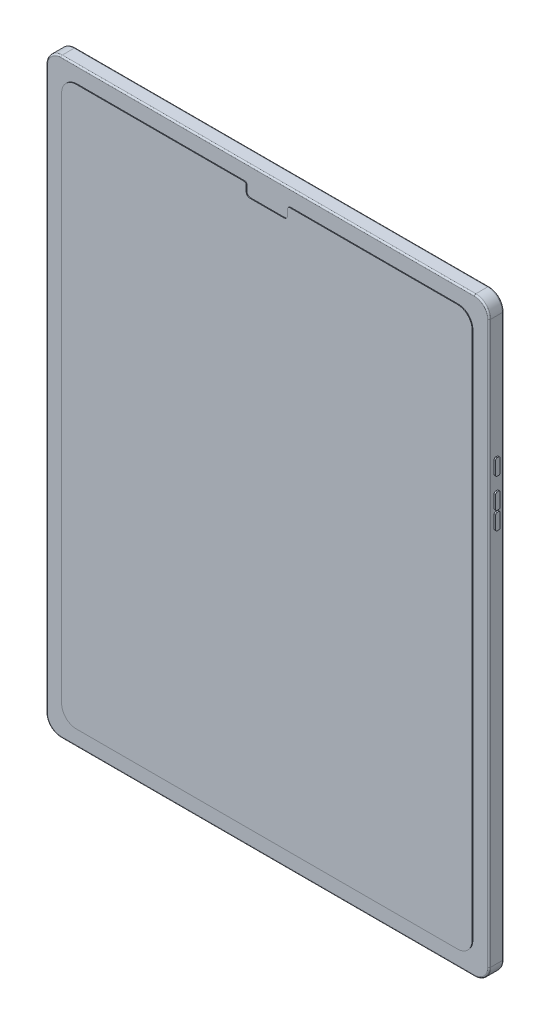
from build123d import *

# Parameters (mm, degrees)
SKETCH1_W           = 30
SKETCH1_H           = 40
BOSS_EXTRUDE1_DEPTH = 1
FILLET1_R           = 1
FILLET2_R           = 0.1
BOSS_EXTRUDE3_DEPTH = 0.05
BOSS_EXTRUDE4_DEPTH = 0.1
SKETCH4_R           = 0.05
CUT_EXTRUDE1_DEPTH  = 0.1
CUT_EXTRUDE2_DEPTH  = 1.5
SKETCH6_R           = 0.125
CUT_EXTRUDE3_DEPTH  = 1
SKETCH7_R           = 0.222610596
SKETCH7_R_2         = 0.109015344
CUT_EXTRUDE4_DEPTH  = 1
SKETCH8_W           = 0.224358974
SKETCH8_H           = 2.5
BOSS_EXTRUDE5_DEPTH = 0.02
SKETCH9_R           = 1.053598775
BOSS_EXTRUDE6_DEPTH = 0.5
FILLET3_R           = 0.25
SKETCH10_R          = 0.195148771
BOSS_EXTRUDE7_DEPTH = 0.1
FILLET4_R           = 0.05


with BuildPart() as part:
    # Sketch1 → Boss-Extrude1 (new body)
    with BuildSketch(Plane.XY):
        Rectangle(SKETCH1_W, SKETCH1_H)
    extrude(amount=BOSS_EXTRUDE1_DEPTH)

    # Fillet1
    fillet1_edges = [part.edges().sort_by_distance(p)[0] for p in [
        (15, -20, 0.5),
        (-15, -20, 0.5),
        (-15, 20, 0.5),
        (15, 20, 0.5),
    ]]
    fillet(fillet1_edges, radius=FILLET1_R)

    # Fillet2
    fillet2_edges = [part.edges().sort_by_distance(p)[0] for p in [
        (15, 0, 0),
        (15, 0, 1),
        (0, -20, 0),
        (-15, 0, 0),
        (0, 20, 0),
        (14.707106781, 19.707106781, 0),
        (-14.707106781, 19.707106781, 0),
        (-14.707106781, -19.707106781, 0),
        (14.707106781, -19.707106781, 0),
        (0, -20, 1),
        (0, 20, 1),
        (-15, 0, 1),
        (14.707106781, 19.707106781, 1),
        (-14.707106781, 19.707106781, 1),
        (-14.707106781, -19.707106781, 1),
        (14.707106781, -19.707106781, 1),
    ]]
    fillet(fillet2_edges, radius=FILLET2_R)

    # Sketch2 → Boss-Extrude3 (add)
    with BuildSketch(Plane.XY.offset(1)):
        with BuildLine():
            Line((-1.55, 18.9), (-12.9, 18.9))
            ThreePointArc((-12.9, 18.9), (-13.607106781, 18.607106781), (-13.9, 17.9))
            Line((-13.9, 17.9), (-13.9, -17.9))
            ThreePointArc((-13.9, -17.9), (-13.607106781, -18.607106781), (-12.9, -18.9))
            Line((-12.9, -18.9), (12.9, -18.9))
            ThreePointArc((12.9, -18.9), (13.607106781, -18.607106781), (13.9, -17.9))
            Line((13.9, -17.9), (13.9, 17.9))
            ThreePointArc((13.9, 17.9), (13.607106781, 18.607106781), (12.9, 18.9))
            Line((12.9, 18.9), (1.55, 18.9))
            ThreePointArc((1.55, 18.9), (1.443933983, 18.856066017), (1.4, 18.75))
            Line((1.4, 18.75), (1.4, 18.35))
            ThreePointArc((1.4, 18.35), (1.326776695, 18.173223305), (1.15, 18.1))
            Line((1.15, 18.1), (-1.15, 18.1))
            ThreePointArc((-1.15, 18.1), (-1.326776695, 18.173223305), (-1.4, 18.35))
            Line((-1.4, 18.35), (-1.4, 18.75))
            ThreePointArc((-1.4, 18.75), (-1.443933983, 18.856066017), (-1.55, 18.9))
        make_face()
    extrude(amount=BOSS_EXTRUDE3_DEPTH)

    # Sketch3 → Boss-Extrude4 (add)
    with BuildSketch(Plane(origin=(15, 0, 0), x_dir=(0, 0, -1), z_dir=(1, 0, 0))):
        with BuildLine():
            Line((-0.657012748, 8.65829626), (-0.657012748, 7.774063936))
            ThreePointArc((-0.657012748, 7.774063936), (-0.627723426, 7.703353258), (-0.557012748, 7.674063936))
            Line((-0.557012748, 7.674063936), (-0.45569959, 7.674063936))
            ThreePointArc((-0.45569959, 7.674063936), (-0.384988911, 7.703353258), (-0.35569959, 7.774063936))
            Line((-0.35569959, 7.774063936), (-0.35569959, 8.65829626))
            ThreePointArc((-0.35569959, 8.65829626), (-0.384988911, 8.729006938), (-0.45569959, 8.75829626))
            Line((-0.45569959, 8.75829626), (-0.557012748, 8.75829626))
            ThreePointArc((-0.557012748, 8.75829626), (-0.627723426, 8.729006938), (-0.657012748, 8.65829626))
        make_face()
        with BuildLine():
            Line((-0.557012748, 10.75829626), (-0.45569959, 10.75829626))
            ThreePointArc((-0.45569959, 10.75829626), (-0.384988911, 10.729006938), (-0.35569959, 10.65829626))
            Line((-0.35569959, 10.65829626), (-0.35569959, 9.774063936))
            ThreePointArc((-0.35569959, 9.774063936), (-0.384988911, 9.703353258), (-0.45569959, 9.674063936))
            Line((-0.45569959, 9.674063936), (-0.557012748, 9.674063936))
            ThreePointArc((-0.557012748, 9.674063936), (-0.627723426, 9.703353258), (-0.657012748, 9.774063936))
            Line((-0.657012748, 9.774063936), (-0.657012748, 10.65829626))
            ThreePointArc((-0.657012748, 10.65829626), (-0.627723426, 10.729006938), (-0.557012748, 10.75829626))
        make_face()
        with BuildLine():
            Line((-0.657012748, 7.45829626), (-0.657012748, 6.574063936))
            ThreePointArc((-0.657012748, 6.574063936), (-0.627723426, 6.503353258), (-0.557012748, 6.474063936))
            Line((-0.557012748, 6.474063936), (-0.45569959, 6.474063936))
            ThreePointArc((-0.45569959, 6.474063936), (-0.384988911, 6.503353258), (-0.35569959, 6.574063936))
            Line((-0.35569959, 6.574063936), (-0.35569959, 7.45829626))
            ThreePointArc((-0.35569959, 7.45829626), (-0.384988911, 7.529006938), (-0.45569959, 7.55829626))
            Line((-0.45569959, 7.55829626), (-0.557012748, 7.55829626))
            ThreePointArc((-0.557012748, 7.55829626), (-0.627723426, 7.529006938), (-0.657012748, 7.45829626))
        make_face()
    extrude(amount=BOSS_EXTRUDE4_DEPTH)

    # Sketch4 → Cut-Extrude1 (cut)
    with BuildSketch(Plane.ZY.offset(15)):
        with Locations(Location((0.5, -17.610032168, 0), (0, 0, 270))):
            Circle(SKETCH4_R)
        with Locations(Location((0.5, -17.453725708, 0), (0, 0, 270))):
            Circle(SKETCH4_R)
    extrude(amount=-CUT_EXTRUDE1_DEPTH, mode=Mode.SUBTRACT)

    # Sketch5 → Cut-Extrude2 (cut)
    with BuildSketch(Plane.XZ.offset(20)):
        with BuildLine():
            Line((-0.5, 0.697077304), (0.5, 0.697077304))
            ThreePointArc((0.5, 0.697077304), (0.718361071, 0.478716233), (0.5, 0.260355162))
            Line((0.5, 0.260355162), (-0.5, 0.260355162))
            ThreePointArc((-0.5, 0.260355162), (-0.718361071, 0.478716233), (-0.5, 0.697077304))
        make_face()
    extrude(amount=-CUT_EXTRUDE2_DEPTH, mode=Mode.SUBTRACT)

    # Sketch6 → Cut-Extrude3 (cut)
    with BuildSketch(Plane.XZ.offset(20)):
        with Locations(Location((-12, 0.476965853, 0), (0, 0, 270))):
            Circle(SKETCH6_R)
        with Locations(Location((-11.5, 0.476965853, 0), (0, 0, 270))):
            Circle(SKETCH6_R)
        with Locations(Location((-11, 0.476965853, 0), (0, 0, 270))):
            Circle(SKETCH6_R)
        with Locations(Location((-10.5, 0.476965853, 0), (0, 0, 270))):
            Circle(SKETCH6_R)
        with Locations(Location((-10, 0.476965853, 0), (0, 0, 270))):
            Circle(SKETCH6_R)
        with Locations(Location((12, 0.5, 0), (0, 0, 270))):
            Circle(SKETCH6_R)
        with Locations(Location((11.5, 0.5, 0), (0, 0, 270))):
            Circle(SKETCH6_R)
        with Locations(Location((11, 0.5, 0), (0, 0, 270))):
            Circle(SKETCH6_R)
        with Locations(Location((10.5, 0.5, 0), (0, 0, 270))):
            Circle(SKETCH6_R)
        with Locations(Location((10, 0.5, 0), (0, 0, 270))):
            Circle(SKETCH6_R)
    extrude(amount=-CUT_EXTRUDE3_DEPTH, mode=Mode.SUBTRACT)

    # Sketch7 → Cut-Extrude4 (cut)
    with BuildSketch(Plane.XZ.offset(20)):
        with Locations(Location((-3.207652456, 0.536786197, 0), (0, 0, 270))):
            Circle(SKETCH7_R)
        with Locations(Location((-2.279239087, 0.536786197, 0), (0, 0, 270))):
            Circle(SKETCH7_R_2)
    extrude(amount=-CUT_EXTRUDE4_DEPTH, mode=Mode.SUBTRACT)

    # Sketch8 → Boss-Extrude5 (add)
    # profile 1 of 7: a face of its own
    with BuildSketch(Plane(origin=(0, 0, 0), x_dir=(-1, 0, 0), z_dir=(0, 0, -1))):
        with Locations((-7.255352287, 1.25)):
            Rectangle(SKETCH8_W, SKETCH8_H)
    # profile 2 of 7: a face of its own
    with BuildSketch(Plane(origin=(0, 0, 0), x_dir=(-1, 0, 0), z_dir=(0, 0, -1))):
        with BuildLine():
            Line((-6.566249723, 1.826923077), (-6.341890749, 1.826923077))
            Line((-6.341890749, 1.826923077), (-6.341890749, 1.497395833))
            add(Edge.make_bspline(
                [(-6.341890749, 1.497395833), (-6.317935295, 1.527283493), (-6.271448901, 1.585281538), (-6.19403152, 1.66151052), (-6.112214449, 1.724328538), (-6.026498732, 1.774402676), (-5.93676801, 1.812150266), (-5.843569246, 1.839411646), (-5.746344456, 1.855757952), (-5.680227001, 1.85789383), (-5.646778569, 1.858974359)],
                knots=[0, 0, 0, 0, 1.12780773, 2.188550248, 3.19190651, 4.159438251, 5.104880172, 6.052711206, 7.014878035, 8, 8, 8, 8], degree=3))
            add(Edge.make_bspline(
                [(-5.646778569, 1.858974359), (-5.612970973, 1.857727791), (-5.546801353, 1.855287956), (-5.450459881, 1.83599032), (-5.360478886, 1.803029423), (-5.277179203, 1.757877944), (-5.202088336, 1.701730463), (-5.136142014, 1.636317762), (-5.081596837, 1.561077703), (-5.045027292, 1.491275448), (-5.020937544, 1.429354881), (-5.005771588, 1.376321488), (-4.992892316, 1.317237094), (-4.981726781, 1.252280245), (-4.974171702, 1.180995823), (-4.968212922, 1.103676043), (-4.963942426, 1.02034595), (-4.963772992, 0.962712645), (-4.96368562, 0.932992788)],
                knots=[0, 0, 0, 0, 1.235846778, 2.418850247, 3.575807741, 4.728682307, 5.871620074, 6.994088408, 8.11269785, 9.256955736, 9.865816715, 10.540099792, 11.271859618, 12.076849838, 12.949306005, 13.892391288, 14.913166135, 16, 16, 16, 16], degree=3))
            Line((-4.96368562, 0.932992788), (-4.96368562, 0))
            Line((-4.96368562, 0), (-5.188044595, 0))
            Line((-5.188044595, 0), (-5.188044595, 0.859375))
            add(Edge.make_bspline(
                [(-5.188044595, 0.859375), (-5.1881826, 0.884248175), (-5.188446582, 0.931826326), (-5.189279187, 0.999947056), (-5.191286191, 1.061723184), (-5.194106415, 1.117007018), (-5.198234294, 1.165745472), (-5.202536173, 1.208037813), (-5.207796871, 1.243830343), (-5.212484666, 1.265376831), (-5.214587063, 1.275040064)],
                knots=[0, 0, 0, 0, 1.430800155, 2.736877192, 3.918605307, 4.986035426, 5.920637409, 6.731861385, 7.431261377, 8, 8, 8, 8], degree=3))
            add(Edge.make_bspline(
                [(-5.214587063, 1.275040064), (-5.222176728, 1.303405196), (-5.236784486, 1.3579993), (-5.272880188, 1.432052409), (-5.318461746, 1.495051114), (-5.374103067, 1.546605915), (-5.439266692, 1.586727941), (-5.513771794, 1.614566481), (-5.596899394, 1.631978101), (-5.655366811, 1.633711767), (-5.685841069, 1.634615385)],
                knots=[0, 0, 0, 0, 1.084156227, 2.086665306, 3.027808233, 3.945421172, 4.874247719, 5.839848303, 6.874090471, 8, 8, 8, 8], degree=3))
            add(Edge.make_bspline(
                [(-5.685841069, 1.634615385), (-5.703889415, 1.634275381), (-5.739606624, 1.633602523), (-5.792570889, 1.626851596), (-5.843945299, 1.615809842), (-5.894245448, 1.600903673), (-5.942465301, 1.580430623), (-5.99015408, 1.557195359), (-6.035516055, 1.52823235), (-6.079518481, 1.495953335), (-6.120456201, 1.460182473), (-6.158547871, 1.422436394), (-6.1925036, 1.382239534), (-6.223266939, 1.340239572), (-6.249822842, 1.295859687), (-6.273003619, 1.24952804), (-6.292671972, 1.201183648), (-6.302445324, 1.167630033), (-6.30733546, 1.150841346)],
                knots=[0, 0, 0, 0, 1.023777757, 2.026029729, 3.023749952, 4.003683103, 4.997618607, 5.993177895, 7.010360494, 8.046726602, 9.087585522, 10.09234134, 11.086953743, 12.070360549, 13.043493632, 14.017870808, 15.008233677, 16, 16, 16, 16], degree=3))
            add(Edge.make_bspline(
                [(-6.30733546, 1.150841346), (-6.310149495, 1.138516201), (-6.316275501, 1.111685005), (-6.322892058, 1.067653277), (-6.328897469, 1.016717581), (-6.333923868, 0.958937354), (-6.336999166, 0.8941103), (-6.340352306, 0.822513273), (-6.341573064, 0.743860782), (-6.341781888, 0.68910243), (-6.341890749, 0.660556891)],
                knots=[0, 0, 0, 0, 0.615963638, 1.340920617, 2.168419149, 3.115676021, 4.16674242, 5.331190069, 6.6087489, 8, 8, 8, 8], degree=3))
            Line((-6.341890749, 0.660556891), (-6.341890749, 0))
            Line((-6.341890749, 0), (-6.566249723, 0))
            Line((-6.566249723, 0), (-6.566249723, 1.826923077))
        make_face()
    # profile 3 of 7: a face of its own
    with BuildSketch(Plane(origin=(0, 0, 0), x_dir=(-1, 0, 0), z_dir=(0, 0, -1))):
        with BuildLine():
            Line((-4.450865108, 1.826923077), (-4.226506133, 1.826923077))
            Line((-4.226506133, 1.826923077), (-4.226506133, 1.497395833))
            add(Edge.make_bspline(
                [(-4.226506133, 1.497395833), (-4.20255068, 1.527283493), (-4.156064286, 1.585281538), (-4.078646905, 1.66151052), (-3.996829833, 1.724328538), (-3.911114117, 1.774402676), (-3.821383395, 1.812150266), (-3.728184631, 1.839411646), (-3.630959841, 1.855757952), (-3.564842386, 1.85789383), (-3.531393954, 1.858974359)],
                knots=[0, 0, 0, 0, 1.12780773, 2.188550248, 3.19190651, 4.159438251, 5.104880172, 6.052711206, 7.014878035, 8, 8, 8, 8], degree=3))
            add(Edge.make_bspline(
                [(-3.531393954, 1.858974359), (-3.497586358, 1.857727791), (-3.431416738, 1.855287956), (-3.335075266, 1.83599032), (-3.24509427, 1.803029423), (-3.161794587, 1.757877944), (-3.086703721, 1.701730463), (-3.020757398, 1.636317762), (-2.966212222, 1.561077703), (-2.929642677, 1.491275448), (-2.905552928, 1.429354881), (-2.890386973, 1.376321488), (-2.8775077, 1.317237094), (-2.866342166, 1.252280245), (-2.858787086, 1.180995823), (-2.852828307, 1.103676043), (-2.848557811, 1.02034595), (-2.848388377, 0.962712645), (-2.848301005, 0.932992788)],
                knots=[0, 0, 0, 0, 1.235846778, 2.418850247, 3.575807741, 4.728682307, 5.871620074, 6.994088408, 8.11269785, 9.256955736, 9.865816715, 10.540099792, 11.271859618, 12.076849838, 12.949306005, 13.892391288, 14.913166135, 16, 16, 16, 16], degree=3))
            Line((-2.848301005, 0.932992788), (-2.848301005, 0))
            Line((-2.848301005, 0), (-3.072659979, 0))
            Line((-3.072659979, 0), (-3.072659979, 0.859375))
            add(Edge.make_bspline(
                [(-3.072659979, 0.859375), (-3.072797985, 0.884248175), (-3.073061967, 0.931826326), (-3.073894571, 0.999947056), (-3.075901576, 1.061723184), (-3.0787218, 1.117007018), (-3.082849678, 1.165745472), (-3.087151558, 1.208037813), (-3.092412256, 1.243830343), (-3.097100051, 1.265376831), (-3.099202447, 1.275040064)],
                knots=[0, 0, 0, 0, 1.430800155, 2.736877192, 3.918605307, 4.986035426, 5.920637409, 6.731861385, 7.431261377, 8, 8, 8, 8], degree=3))
            add(Edge.make_bspline(
                [(-3.099202447, 1.275040064), (-3.106792113, 1.303405196), (-3.12139987, 1.3579993), (-3.157495572, 1.432052409), (-3.20307713, 1.495051114), (-3.258718451, 1.546605915), (-3.323882077, 1.586727941), (-3.398387179, 1.614566481), (-3.481514779, 1.631978101), (-3.539982195, 1.633711767), (-3.570456454, 1.634615385)],
                knots=[0, 0, 0, 0, 1.084156227, 2.086665306, 3.027808233, 3.945421172, 4.874247719, 5.839848303, 6.874090471, 8, 8, 8, 8], degree=3))
            add(Edge.make_bspline(
                [(-3.570456454, 1.634615385), (-3.588504799, 1.634275381), (-3.624222008, 1.633602523), (-3.677186274, 1.626851596), (-3.728560683, 1.615809842), (-3.778860833, 1.600903673), (-3.827080685, 1.580430623), (-3.874769465, 1.557195359), (-3.920131439, 1.52823235), (-3.964133866, 1.495953335), (-4.005071585, 1.460182473), (-4.043163256, 1.422436394), (-4.077118985, 1.382239534), (-4.107882324, 1.340239572), (-4.134438226, 1.295859687), (-4.157619004, 1.24952804), (-4.177287357, 1.201183648), (-4.187060709, 1.167630033), (-4.191950845, 1.150841346)],
                knots=[0, 0, 0, 0, 1.023777757, 2.026029729, 3.023749952, 4.003683103, 4.997618607, 5.993177895, 7.010360494, 8.046726602, 9.087585522, 10.09234134, 11.086953743, 12.070360549, 13.043493632, 14.017870808, 15.008233677, 16, 16, 16, 16], degree=3))
            add(Edge.make_bspline(
                [(-4.191950845, 1.150841346), (-4.194764879, 1.138516201), (-4.200890886, 1.111685005), (-4.207507443, 1.067653277), (-4.213512854, 1.016717581), (-4.218539253, 0.958937354), (-4.22161455, 0.8941103), (-4.224967691, 0.822513273), (-4.226188449, 0.743860782), (-4.226397273, 0.68910243), (-4.226506133, 0.660556891)],
                knots=[0, 0, 0, 0, 0.615963638, 1.340920617, 2.168419149, 3.115676021, 4.16674242, 5.331190069, 6.6087489, 8, 8, 8, 8], degree=3))
            Line((-4.226506133, 0.660556891), (-4.226506133, 0))
            Line((-4.226506133, 0), (-4.450865108, 0))
            Line((-4.450865108, 0), (-4.450865108, 1.826923077))
        make_face()
    # profile 4 of 7: a face of its own
    with BuildSketch(Plane(origin=(0, 0, 0), x_dir=(-1, 0, 0), z_dir=(0, 0, -1))):
        with BuildLine():
            add(Edge.make_bspline(
                [(-1.453068633, 1.858974359), (-1.418789153, 1.858244437), (-1.351575469, 1.856813238), (-1.253141264, 1.841516834), (-1.159180453, 1.818125859), (-1.069333173, 1.785789029), (-0.984750105, 1.742444779), (-0.904199216, 1.690723856), (-0.827901353, 1.629450575), (-0.782170617, 1.582051955), (-0.758958056, 1.557992788)],
                knots=[0, 0, 0, 0, 1.054011418, 2.066658804, 3.057071809, 4.030435133, 4.997543892, 5.974964718, 6.972108034, 8, 8, 8, 8], degree=3))
            add(Edge.make_bspline(
                [(-0.758958056, 1.557992788), (-0.738970946, 1.534982799), (-0.699383532, 1.489408126), (-0.648622304, 1.415511259), (-0.604892618, 1.338982616), (-0.569847646, 1.258805954), (-0.542215486, 1.175681189), (-0.522597132, 1.08932261), (-0.510927893, 0.999920933), (-0.509354345, 0.939203906), (-0.508557415, 0.908453526)],
                knots=[0, 0, 0, 0, 1.025258237, 2.030674902, 3.01204498, 3.988269485, 4.97094183, 5.956517959, 6.965070386, 8, 8, 8, 8], degree=3))
            add(Edge.make_bspline(
                [(-0.508557415, 0.908453526), (-0.50925837, 0.877524913), (-0.510643491, 0.816408532), (-0.523746074, 0.726394699), (-0.544125421, 0.639112683), (-0.57329102, 0.554927902), (-0.610689669, 0.473583025), (-0.656325874, 0.395433347), (-0.710519887, 0.32032468), (-0.771951313, 0.248894796), (-0.83984551, 0.183061785), (-0.913499902, 0.12568445), (-0.991467069, 0.076526218), (-1.07478375, 0.036928779), (-1.162689097, 0.005707564), (-1.255372718, -0.016221019), (-1.352690625, -0.029479365), (-1.41913864, -0.031181917), (-1.453068633, -0.032051282)],
                knots=[0, 0, 0, 0, 0.998656419, 1.973391657, 2.932242238, 3.890759089, 4.846373663, 5.82037756, 6.809684879, 7.83454468, 8.860553229, 9.859544525, 10.845671541, 11.83227036, 12.833544569, 13.85385346, 14.904124723, 16, 16, 16, 16], degree=3))
            add(Edge.make_bspline(
                [(-1.453068633, -0.032051282), (-1.487164861, -0.031178999), (-1.553944047, -0.029470589), (-1.651605463, -0.01627253), (-1.74445519, 0.005697458), (-1.832475618, 0.037031381), (-1.916150509, 0.076527484), (-1.994569435, 0.125535834), (-2.06828366, 0.183078802), (-2.136192221, 0.248890185), (-2.197619796, 0.320325868), (-2.251814802, 0.395433039), (-2.297450749, 0.473583106), (-2.334849466, 0.55492788), (-2.364015047, 0.639112689), (-2.384394399, 0.726394698), (-2.397496981, 0.816408532), (-2.398882101, 0.877524913), (-2.399583056, 0.908453526)],
                knots=[0, 0, 0, 0, 1.099876186, 2.154163076, 3.173186993, 4.173200201, 5.163417411, 6.152872554, 7.150605724, 8.17532212, 9.198891216, 10.186952605, 11.159729845, 12.11414092, 13.071450619, 14.029093627, 15.002601286, 16, 16, 16, 16], degree=3))
            add(Edge.make_bspline(
                [(-2.399583056, 0.908453526), (-2.398780692, 0.939036773), (-2.397192148, 0.999586346), (-2.385534641, 1.088819961), (-2.365992815, 1.175032381), (-2.338327532, 1.257836293), (-2.302959539, 1.337661604), (-2.259844333, 1.414379341), (-2.20856531, 1.487942055), (-2.169135344, 1.533457827), (-2.149182415, 1.556490385)],
                knots=[0, 0, 0, 0, 1.031353054, 2.041901799, 3.029428768, 4.008703097, 4.981709435, 5.96992636, 6.972712378, 8, 8, 8, 8], degree=3))
            add(Edge.make_bspline(
                [(-2.149182415, 1.556490385), (-2.12600485, 1.580758198), (-2.08042209, 1.628485124), (-2.003744428, 1.689579784), (-1.923391698, 1.74237698), (-1.837873894, 1.784859991), (-1.748100424, 1.818316075), (-1.653658108, 1.841577157), (-1.554889883, 1.856758125), (-1.487347296, 1.858228252), (-1.453068633, 1.858974359)],
                knots=[0, 0, 0, 0, 1.027980169, 2.021703884, 2.998553061, 3.971491411, 4.943284454, 5.930300938, 6.949603206, 8, 8, 8, 8], degree=3))
        make_face()
        with BuildLine():
            add(Edge.make_bspline(
                [(-1.454070236, 1.634615385), (-1.478311387, 1.633926391), (-1.526167907, 1.632566189), (-1.596610468, 1.622220543), (-1.664424863, 1.605829468), (-1.729739752, 1.582540857), (-1.792334875, 1.552470214), (-1.852270163, 1.515535671), (-1.909721905, 1.472226417), (-1.963566236, 1.422610223), (-2.012982174, 1.368410941), (-2.056180728, 1.310662113), (-2.092912947, 1.250300437), (-2.123513061, 1.187263144), (-2.146303909, 1.120911419), (-2.162856068, 1.051996683), (-2.173191954, 0.980378528), (-2.174539368, 0.931692087), (-2.175224082, 0.906951122)],
                knots=[0, 0, 0, 0, 1.021534396, 2.016698045, 2.994645724, 3.958388632, 4.93408049, 5.916473867, 6.921342795, 7.962252576, 8.998418191, 10.008913653, 10.997312074, 11.973003931, 12.956656626, 13.948281152, 14.957379055, 16, 16, 16, 16], degree=3))
            add(Edge.make_bspline(
                [(-2.175224082, 0.906951122), (-2.174076351, 0.874985388), (-2.171798319, 0.811539384), (-2.15327315, 0.718102868), (-2.12228295, 0.628401545), (-2.080434893, 0.542961269), (-2.02800188, 0.463909642), (-1.966225404, 0.39343001), (-1.895768475, 0.332583002), (-1.817470975, 0.282096684), (-1.732932176, 0.241982573), (-1.643463375, 0.213554733), (-1.550148594, 0.195074953), (-1.486376643, 0.193238185), (-1.454070236, 0.192307692)],
                knots=[0, 0, 0, 0, 1.016792936, 2.018143844, 3.017858371, 4.030088057, 5.03801393, 6.028138512, 7.003788237, 7.991172063, 8.984598303, 9.972568034, 10.972917682, 12, 12, 12, 12], degree=3))
            add(Edge.make_bspline(
                [(-1.454070236, 0.192307692), (-1.421765686, 0.193243607), (-1.357997404, 0.195091076), (-1.264812277, 0.213461661), (-1.175588012, 0.242107133), (-1.091137021, 0.282051569), (-1.012875161, 0.332774722), (-0.941911503, 0.39308642), (-0.880662495, 0.464096314), (-0.828281349, 0.543065978), (-0.785747961, 0.628269086), (-0.754902817, 0.718119424), (-0.736333113, 0.811535168), (-0.734061092, 0.874983976), (-0.73291639, 0.906951122)],
                knots=[0, 0, 0, 0, 1.02726834, 2.027799167, 3.010890988, 4.004497153, 4.992059811, 5.971914811, 6.958719428, 7.966827853, 8.981595046, 9.981490638, 10.983022906, 12, 12, 12, 12], degree=3))
            add(Edge.make_bspline(
                [(-0.73291639, 0.906951122), (-0.733600868, 0.931692234), (-0.734947818, 0.980378967), (-0.745287078, 1.051995005), (-0.761826749, 1.120917574), (-0.784663618, 1.187240434), (-0.815130771, 1.250463651), (-0.852571338, 1.310484885), (-0.895593499, 1.368610989), (-0.945605728, 1.422435018), (-0.999393855, 1.472245759), (-1.056868882, 1.515552465), (-1.116715296, 1.552307891), (-1.179128569, 1.582798063), (-1.244451831, 1.605617591), (-1.312171209, 1.622315185), (-1.382313217, 1.632522469), (-1.429998247, 1.633913284), (-1.454070236, 1.634615385)],
                knots=[0, 0, 0, 0, 1.042956736, 2.052379634, 3.044323526, 4.02829302, 5.004299113, 5.996692471, 7.007513377, 8.048758398, 9.090003419, 10.095195979, 11.07790575, 12.047570684, 13.018257071, 13.989683339, 14.985167495, 16, 16, 16, 16], degree=3))
        make_face(mode=Mode.SUBTRACT)
    # profile 5 of 7: a face of its own
    with BuildSketch(Plane(origin=(0, 0, 0), x_dir=(-1, 0, 0), z_dir=(0, 0, -1))):
        with BuildLine():
            Line((2.311955405, 2.041266026), (2.115641303, 1.891025641))
            add(Edge.make_bspline(
                [(2.115641303, 1.891025641), (2.101637097, 1.907715619), (2.073817492, 1.940870559), (2.029060919, 1.987427377), (1.982416888, 2.031045421), (1.93390323, 2.071932478), (1.882646716, 2.108658739), (1.829889003, 2.143138098), (1.774747542, 2.174043625), (1.698496303, 2.211517187), (1.59874784, 2.250621583), (1.473180098, 2.283409605), (1.342100742, 2.304281874), (1.252673885, 2.306542475), (1.207187777, 2.307692308)],
                knots=[0, 0, 0, 0, 0.757959112, 1.505699292, 2.245454638, 2.979532153, 3.711538275, 4.438200793, 5.171680507, 5.909471876, 7.393775596, 8.890124382, 10.418191784, 12, 12, 12, 12], degree=3))
            add(Edge.make_bspline(
                [(1.207187777, 2.307692308), (1.182128278, 2.307403763), (1.132241854, 2.306829352), (1.05820723, 2.299251405), (0.985555051, 2.288600541), (0.914332575, 2.272796739), (0.844630462, 2.252816296), (0.775993032, 2.228941001), (0.709414032, 2.199401829), (0.643972433, 2.166753072), (0.581272997, 2.129876326), (0.521947963, 2.089652503), (0.4662137, 2.04653172), (0.41402612, 2.000352358), (0.365331871, 1.951322387), (0.320483792, 1.898919285), (0.27963707, 1.84331059), (0.241982052, 1.785229585), (0.208258671, 1.724845448), (0.180023043, 1.661934683), (0.155019384, 1.59757461), (0.135234211, 1.531038066), (0.119573842, 1.462793233), (0.108768368, 1.392656956), (0.101276603, 1.320775757), (0.100705048, 1.272054819), (0.100416944, 1.247495994)],
                knots=[0, 0, 0, 0, 1.054917814, 2.100044995, 3.131103042, 4.146048494, 5.169673617, 6.183595914, 7.203665975, 8.234915748, 9.262203917, 10.264457458, 11.251630812, 12.227803204, 13.197192746, 14.159520551, 15.12972552, 16.100847026, 17.073214652, 18.039054194, 19.002613845, 19.979014051, 20.95965708, 21.949030935, 22.966165397, 24, 24, 24, 24], degree=3))
            add(Edge.make_bspline(
                [(0.100416944, 1.247495994), (0.101318243, 1.210545051), (0.103087825, 1.137996776), (0.118836635, 1.031732054), (0.142768843, 0.929931573), (0.178637112, 0.833231685), (0.222865005, 0.740440001), (0.278751156, 0.653126534), (0.343477254, 0.569971845), (0.417958983, 0.492941168), (0.499677423, 0.422574222), (0.587354502, 0.360609521), (0.680771851, 0.308956033), (0.778898015, 0.265973214), (0.882488097, 0.232932695), (0.991355813, 0.209672606), (1.105264381, 0.19449962), (1.183099666, 0.193046986), (1.222712617, 0.192307692)],
                knots=[0, 0, 0, 0, 1.029171465, 2.020641659, 2.987623507, 3.938342917, 4.889210282, 5.84687017, 6.821220943, 7.821438502, 8.827599549, 9.822697543, 10.807740252, 11.797342354, 12.80366471, 13.83203677, 14.896651826, 16, 16, 16, 16], degree=3))
            add(Edge.make_bspline(
                [(1.222712617, 0.192307692), (1.266357395, 0.193513964), (1.352260758, 0.195888194), (1.47823792, 0.216001943), (1.598834895, 0.248614742), (1.714058171, 0.294256115), (1.823582919, 0.353588463), (1.927580533, 0.425515519), (2.026138798, 0.510721471), (2.085403999, 0.575780848), (2.115641303, 0.608974359)],
                knots=[0, 0, 0, 0, 1.028121516, 2.023589091, 2.998037872, 3.967518031, 4.937445131, 5.927275754, 6.942489185, 8, 8, 8, 8], degree=3))
            Line((2.115641303, 0.608974359), (2.311955405, 0.460236378))
            add(Edge.make_bspline(
                [(2.311955405, 0.460236378), (2.296156755, 0.43985177), (2.26463513, 0.399180194), (2.213593689, 0.341843258), (2.159824191, 0.287911804), (2.102927256, 0.237820646), (2.043557404, 0.190567457), (1.98064861, 0.14749472), (1.915027872, 0.108001231), (1.84691753, 0.071839142), (1.77638995, 0.039755394), (1.703529639, 0.012288417), (1.628650657, -0.011372218), (1.551749579, -0.030837887), (1.472666896, -0.046031518), (1.391687986, -0.056188429), (1.308638075, -0.063146939), (1.252608488, -0.063781165), (1.224215021, -0.064102564)],
                knots=[0, 0, 0, 0, 0.986787822, 1.968848986, 2.935600012, 3.899624008, 4.868462664, 5.837806735, 6.815139263, 7.798259679, 8.787526145, 9.778297419, 10.776456485, 11.791383307, 12.812564526, 13.85620153, 14.913611965, 16, 16, 16, 16], degree=3))
            add(Edge.make_bspline(
                [(1.224215021, -0.064102564), (1.197326687, -0.063915427), (1.144158337, -0.063545385), (1.065659229, -0.05755098), (0.9892381, -0.049372596), (0.915113367, -0.037058217), (0.842880527, -0.022526546), (0.773194396, -0.003047077), (0.705369245, 0.018773757), (0.639677574, 0.044420176), (0.576063502, 0.073360306), (0.514732208, 0.106068562), (0.4557119, 0.142269894), (0.398422313, 0.18116633), (0.343709753, 0.22400726), (0.291100092, 0.270197714), (0.240298324, 0.319582007), (0.208867834, 0.355192616), (0.193065181, 0.373096955)],
                knots=[0, 0, 0, 0, 1.114604814, 2.203992996, 3.262667896, 4.300477797, 5.318619304, 6.316056647, 7.298880507, 8.271930387, 9.238335007, 10.195173496, 11.151986948, 12.108099108, 13.064862484, 14.031167946, 15.010108607, 16, 16, 16, 16], degree=3))
            add(Edge.make_bspline(
                [(0.193065181, 0.373096955), (0.167754007, 0.404197804), (0.117437238, 0.466024026), (0.05306175, 0.566228298), (-0.002043647, 0.670848448), (-0.046597876, 0.780434111), (-0.0814284, 0.894739388), (-0.105557825, 1.013821898), (-0.121237542, 1.137570428), (-0.123030606, 1.221739563), (-0.123942031, 1.264523237)],
                knots=[0, 0, 0, 0, 0.994628077, 1.977248131, 2.950237994, 3.925870899, 4.908910175, 5.911660606, 6.938484602, 8, 8, 8, 8], degree=3))
            add(Edge.make_bspline(
                [(-0.123942031, 1.264523237), (-0.122831178, 1.309491418), (-0.120645645, 1.397963507), (-0.10207722, 1.527802045), (-0.072206651, 1.652195902), (-0.029780302, 1.770912862), (0.024009235, 1.884577348), (0.090456816, 1.992321066), (0.168790489, 2.094833065), (0.258395894, 2.190557888), (0.356658277, 2.278085997), (0.461886001, 2.355090428), (0.573873106, 2.419174368), (0.691385857, 2.472743056), (0.815304201, 2.513917672), (0.945363751, 2.542741377), (1.081320118, 2.560682174), (1.174078994, 2.56295018), (1.221210213, 2.564102564)],
                knots=[0, 0, 0, 0, 1.032925535, 2.032216505, 3.007276963, 3.968222605, 4.92396291, 5.891752235, 6.871517503, 7.883894988, 8.900124299, 9.891468569, 10.874487609, 11.85992873, 12.854644235, 13.869047385, 14.917252991, 16, 16, 16, 16], degree=3))
            add(Edge.make_bspline(
                [(1.221210213, 2.564102564), (1.249934836, 2.56375818), (1.306792334, 2.563076505), (1.390901371, 2.556429261), (1.472788748, 2.545348114), (1.552510878, 2.530265207), (1.630455604, 2.511545691), (1.706027204, 2.487159764), (1.779669123, 2.459276527), (1.850916915, 2.427163337), (1.919428736, 2.391115665), (1.98518325, 2.351533077), (2.047658149, 2.308464644), (2.107293041, 2.262276662), (2.163090334, 2.211991977), (2.216634247, 2.158993694), (2.266106446, 2.101755248), (2.296644442, 2.061466009), (2.311955405, 2.041266026)],
                knots=[0, 0, 0, 0, 1.096760587, 2.17092713, 3.219439832, 4.250915756, 5.268269357, 6.278326846, 7.281116186, 8.274029601, 9.260640565, 10.235837813, 11.203064059, 12.156899882, 13.114053108, 14.069676657, 15.032185724, 16, 16, 16, 16], degree=3))
        make_face()
    # profile 6 of 7: a face of its own
    with BuildSketch(Plane(origin=(0, 0, 0), x_dir=(-1, 0, 0), z_dir=(0, 0, -1))):
        Polygon((3.850416944, 2.5), (5.004263098, 0), (4.760372873, 0), (4.390781527, 0.801282051), (3.257468226, 0.801282051), (2.877860854, 0), (2.632468226, 0), (3.818365662, 2.5), align=None)
        Polygon((3.831887296, 2.012219551), (3.379663739, 1.057692308), (4.272592425, 1.057692308), align=None, mode=Mode.SUBTRACT)
    # profile 7 of 7: a face of its own
    with BuildSketch(Plane(origin=(0, 0, 0), x_dir=(-1, 0, 0), z_dir=(0, 0, -1))):
        with BuildLine():
            Line((5.452981046, 0), (5.452981046, 2.5))
            Line((5.452981046, 2.5), (5.957788739, 2.5))
            add(Edge.make_bspline(
                [(5.957788739, 2.5), (6.001695159, 2.499683879), (6.086522134, 2.499073134), (6.209102454, 2.495200711), (6.322519427, 2.488350379), (6.42640004, 2.478372146), (6.521029478, 2.466119979), (6.606142769, 2.450762547), (6.682180014, 2.43262814), (6.7289439, 2.417167104), (6.751057969, 2.409855769)],
                knots=[0, 0, 0, 0, 1.314313732, 2.53924729, 3.670748893, 4.714932338, 5.66265055, 6.526160246, 7.303039223, 8, 8, 8, 8], degree=3))
            add(Edge.make_bspline(
                [(6.751057969, 2.409855769), (6.779982783, 2.398833837), (6.837176492, 2.377039912), (6.918610151, 2.335928268), (6.995271124, 2.289347482), (7.067570514, 2.237236151), (7.133856818, 2.178118759), (7.196719602, 2.114506555), (7.253587261, 2.044086312), (7.305664616, 1.968318464), (7.352618658, 1.888095569), (7.393432342, 1.803570492), (7.427328052, 1.715172486), (7.455466071, 1.62314738), (7.477642112, 1.527292825), (7.492772063, 1.427497206), (7.502751342, 1.324154928), (7.503754236, 1.254030311), (7.504263098, 1.218449519)],
                knots=[0, 0, 0, 0, 0.984719456, 1.947108742, 2.898477687, 3.838006223, 4.779231079, 5.722358779, 6.681677486, 7.655904652, 8.64651281, 9.637519902, 10.640069247, 11.656948941, 12.698408672, 13.768548281, 14.867775369, 16, 16, 16, 16], degree=3))
            add(Edge.make_bspline(
                [(7.504263098, 1.218449519), (7.503813835, 1.187548635), (7.502928516, 1.126655214), (7.494979005, 1.036911717), (7.483424491, 0.949830595), (7.465535778, 0.865826523), (7.443819697, 0.78416351), (7.41598816, 0.705711907), (7.384105663, 0.629752044), (7.346927178, 0.557310989), (7.306111903, 0.488680009), (7.262310658, 0.423983203), (7.215570162, 0.364143759), (7.16544471, 0.308980465), (7.112582055, 0.25857648), (7.056636104, 0.212510755), (6.997462497, 0.171684644), (6.935326266, 0.134493853), (6.868414745, 0.102050742), (6.795460555, 0.074600735), (6.716152571, 0.051853152), (6.630685459, 0.032873941), (6.538911546, 0.017818725), (6.440740856, 0.007728445), (6.336324221, 0.000904921), (6.264624746, 0.000307497), (6.22772063, 0)],
                knots=[0, 0, 0, 0, 1.105936401, 2.179363191, 3.223086493, 4.248585256, 5.251745608, 6.245858792, 7.225916811, 8.198733463, 9.158002045, 10.082870192, 10.993790845, 11.873723703, 12.748670949, 13.606408763, 14.465103618, 15.319838547, 16.196477973, 17.123216899, 18.106603292, 19.147568657, 20.255746949, 21.433717677, 22.679120308, 24, 24, 24, 24], degree=3))
            Line((6.22772063, 0), (5.452981046, 0))
        make_face()
        with BuildLine():
            Line((5.677340021, 0.256410256), (5.964299155, 0.256410256))
            add(Edge.make_bspline(
                [(5.964299155, 0.256410256), (6.005533706, 0.256587468), (6.084842848, 0.256928311), (6.198884274, 0.25991917), (6.303083843, 0.264806269), (6.39745635, 0.27164561), (6.48194851, 0.280694621), (6.556736903, 0.290783837), (6.621576373, 0.303353445), (6.660811685, 0.314746987), (6.678942585, 0.320012019)],
                knots=[0, 0, 0, 0, 1.375205317, 2.645023457, 3.804390687, 4.853969522, 5.800190428, 6.637939096, 7.370582563, 8, 8, 8, 8], degree=3))
            add(Edge.make_bspline(
                [(6.678942585, 0.320012019), (6.701762843, 0.328048847), (6.746858299, 0.343930542), (6.81177336, 0.3729003), (6.872314078, 0.407216064), (6.929535524, 0.445360545), (6.982625993, 0.488679118), (7.032214647, 0.536229824), (7.078201648, 0.588254664), (7.120111868, 0.644689065), (7.157617799, 0.705181776), (7.190097249, 0.769138086), (7.218562629, 0.835857236), (7.240904481, 0.906363778), (7.258415612, 0.980027391), (7.270818961, 1.056853258), (7.278543764, 1.13682703), (7.279444798, 1.191221405), (7.279904123, 1.218950321)],
                knots=[0, 0, 0, 0, 0.998632004, 1.973411704, 2.929992603, 3.868527914, 4.809262121, 5.754881198, 6.702106254, 7.672490631, 8.653608572, 9.636854334, 10.631411391, 11.644891563, 12.686317036, 13.754757253, 14.855430412, 16, 16, 16, 16], degree=3))
            add(Edge.make_bspline(
                [(7.279904123, 1.218950321), (7.279537489, 1.248188521), (7.278817234, 1.305627224), (7.269764155, 1.389906292), (7.256534473, 1.470963899), (7.237403268, 1.548805468), (7.213024069, 1.623582862), (7.182599325, 1.694882512), (7.147837454, 1.763457418), (7.106477928, 1.827724823), (7.061181075, 1.888505615), (7.010911162, 1.944187697), (6.956466848, 1.994897912), (6.898441956, 2.041425992), (6.835201171, 2.081900046), (6.768234249, 2.118104819), (6.696558769, 2.148830455), (6.646692558, 2.1651725), (6.621350437, 2.173477564)],
                knots=[0, 0, 0, 0, 1.122418816, 2.205001699, 3.251619955, 4.274784885, 5.280384055, 6.268708349, 7.249350384, 8.229342522, 9.199999885, 10.157847722, 11.105861043, 12.055065948, 13.010012805, 13.98527497, 14.976112212, 16, 16, 16, 16], degree=3))
            add(Edge.make_bspline(
                [(6.621350437, 2.173477564), (6.600385333, 2.179275013), (6.555807768, 2.191601979), (6.483065294, 2.205048673), (6.40119733, 2.21690903), (6.309840401, 2.226950486), (6.209098644, 2.234155716), (6.098894581, 2.239563798), (5.979180578, 2.243211392), (5.896193054, 2.243460469), (5.853121271, 2.243589744)],
                knots=[0, 0, 0, 0, 0.674548936, 1.434276114, 2.292660221, 3.240891867, 4.284742987, 5.42552168, 6.663806718, 8, 8, 8, 8], degree=3))
            Line((5.853121271, 2.243589744), (5.677340021, 2.243589744))
            Line((5.677340021, 2.243589744), (5.677340021, 0.256410256))
        make_face(mode=Mode.SUBTRACT)
    extrude(amount=BOSS_EXTRUDE5_DEPTH)

    # Sketch9 → Boss-Extrude6 (add)
    with BuildSketch(Plane(origin=(0, 0, 0), x_dir=(-1, 0, 0), z_dir=(0, 0, -1))):
        with Locations(Location((12.267723154, 17.662638268, 0), (0, 0, 180))):
            Circle(SKETCH9_R)
    extrude(amount=BOSS_EXTRUDE6_DEPTH)

    # Fillet3
    fillet3_edges = [part.edges().sort_by_distance(p)[0] for p in [
        (-13.321321929, 17.662638268, -0.5),
    ]]
    fillet(fillet3_edges, radius=FILLET3_R)

    # Sketch10 → Boss-Extrude7 (add)
    with BuildSketch(Plane(origin=(0, 0, 0), x_dir=(-1, 0, 0), z_dir=(0, 0, -1))):
        with Locations(Location((12.267723154, 15.76845506, 0), (0, 0, 180))):
            Circle(SKETCH10_R)
    extrude(amount=BOSS_EXTRUDE7_DEPTH)

    # Fillet4
    fillet4_edges = [part.edges().sort_by_distance(p)[0] for p in [
        (-12.462871926, 15.76845506, -0.1),
    ]]
    fillet(fillet4_edges, radius=FILLET4_R)


solid = part.part
